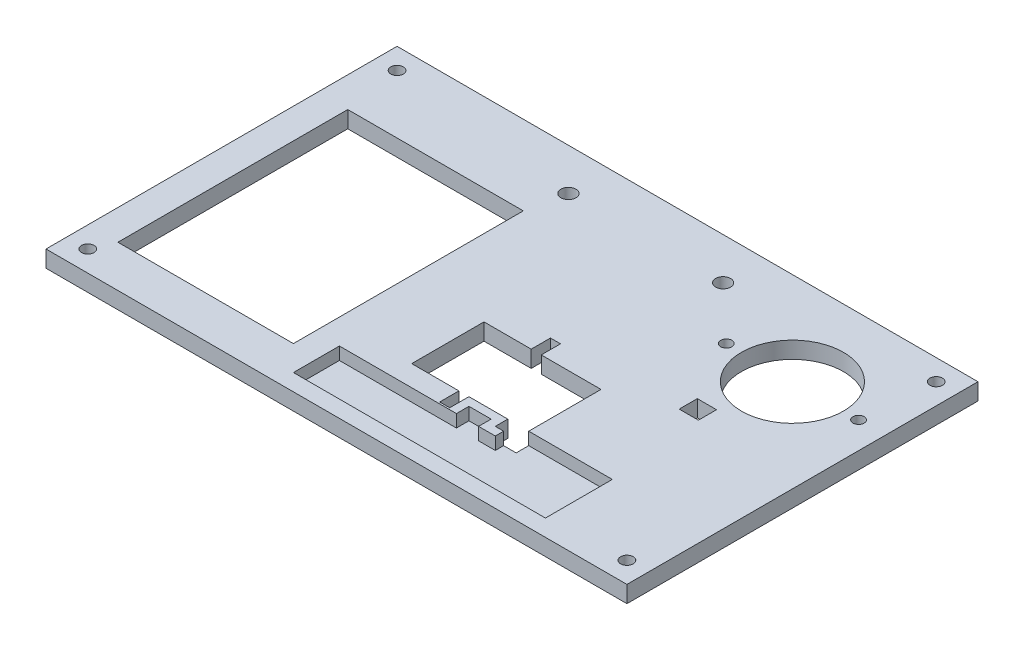
from build123d import *

# Parameters (mm, degrees)
BOSS_EXTRUDE1_DEPTH = 5.08
SKETCH3_R           = 1.905
CUT_EXTRUDE1_DEPTH  = 104.255373831
SKETCH4_R           = 1.905
SKETCH4_R_2         = 2.286
CUT_EXTRUDE2_DEPTH  = 104.255373831
CUT_EXTRUDE3_DEPTH  = 104.255373831
SKETCH6_R           = 15.494
SKETCH6_R_2         = 1.7
CUT_EXTRUDE4_DEPTH  = 104.255373831
SKETCH7_W           = 53.34
SKETCH7_H           = 69.85
CUT_EXTRUDE5_DEPTH  = 104.255373831
SKETCH8_W           = 5.838418679
SKETCH8_H           = 5.514062087
CUT_EXTRUDE6_DEPTH  = 104.255373831
CUT_EXTRUDE7_DEPTH  = 3.81


with BuildPart() as part:
    # Sketch1 → Boss-Extrude1 (new body)
    with BuildSketch(Plane(origin=(0, 0, 0), x_dir=(1, 0, 0), z_dir=(0, 1, 0))):
        Polygon((-15.621, -53.34), (15.621, -53.34), (88.265, -53.34), (88.265, 53.34), (-88.265, 53.34), (-88.265, -53.34), align=None)
    extrude(amount=BOSS_EXTRUDE1_DEPTH)

    # Sketch3 → Cut-Extrude1 (cut, through all)
    with BuildSketch(Plane(origin=(0, 5.08, 0), x_dir=(1, 0, 0), z_dir=(0, 1, 0))):
        with Locations(Location((-81.915, 46.99, 0), (0, 0, 270))):
            Circle(SKETCH3_R)
    extrude(amount=-CUT_EXTRUDE1_DEPTH, mode=Mode.SUBTRACT)

    # Sketch4 → Cut-Extrude2 (cut, through all)
    with BuildSketch(Plane(origin=(0, 5.08, 0), x_dir=(1, 0, 0), z_dir=(0, 1, 0))):
        with Locations(Location((81.915, 46.99, 0), (0, 0, 270))):
            Circle(SKETCH4_R)
        with Locations(Location((-81.915, -46.99, 0), (0, 0, 270))):
            Circle(SKETCH4_R)
        with Locations(Location((81.915, -46.99, 0), (0, 0, 270))):
            Circle(SKETCH4_R)
        with Locations(Location((23.495, 40.64, 0), (0, 0, 270))):
            Circle(SKETCH4_R_2)
        with Locations(Location((-23.495, 40.64, 0), (0, 0, 270))):
            Circle(SKETCH4_R_2)
    extrude(amount=-CUT_EXTRUDE2_DEPTH, mode=Mode.SUBTRACT)

    # Sketch5 → Cut-Extrude3 (cut, through all)
    with BuildSketch(Plane.XZ):
        Polygon((-2.54, 27.94), (-2.54, 5.969), (11.811, 5.969), (11.811, 0.127), (14.859, 0.127), (14.859, 5.969), (33.02, 5.969), (33.02, 29.21), (33.02, 31.75), (26.67, 31.75), (26.67, 27.94), (25.80916534, 27.94), (14.859, 27.94), (14.859, 33.782), (11.811, 33.782), (11.811, 27.94), align=None)
    extrude(amount=-CUT_EXTRUDE3_DEPTH, mode=Mode.SUBTRACT)

    # Sketch6 → Cut-Extrude4 (cut, through all)
    with BuildSketch(Plane(origin=(0, 5.08, 0), x_dir=(1, 0, 0), z_dir=(0, 1, 0))):
        with Locations(Location((60.071, 25.146, 0), (0, 0, 270))):
            Circle(SKETCH6_R)
        with Locations(Location((39.9778, 25.146, 0), (0, 0, 270))):
            Circle(SKETCH6_R_2)
        with Locations(Location((80.1642, 25.146, 0), (0, 0, 270))):
            Circle(SKETCH6_R_2)
    extrude(amount=-CUT_EXTRUDE4_DEPTH, mode=Mode.SUBTRACT)

    # Sketch7 → Cut-Extrude5 (cut, through all)
    with BuildSketch(Plane(origin=(0, 5.08, 0), x_dir=(1, 0, 0), z_dir=(0, 1, 0))):
        with Locations((-52.451, -5.715)):
            Rectangle(SKETCH7_W, SKETCH7_H)
    extrude(amount=-CUT_EXTRUDE5_DEPTH, mode=Mode.SUBTRACT)

    # Sketch8 → Cut-Extrude6 (cut, through all)
    with BuildSketch(Plane(origin=(0, 5.08, 0), x_dir=(1, 0, 0), z_dir=(0, 1, 0))):
        with Locations((52.991758435, 3.486833379)):
            Rectangle(SKETCH8_W, SKETCH8_H)
    extrude(amount=-CUT_EXTRUDE6_DEPTH, mode=Mode.SUBTRACT)

    # Sketch9 → Cut-Extrude7 (cut)
    with BuildSketch(Plane(origin=(0, 5.08, 0), x_dir=(1, 0, 0), z_dir=(0, 1, 0))):
        Polygon((29.21, -27.94), (58.42, -27.94), (58.42, -48.26), (32.552533169, -48.26), (-18.161, -48.26), (-18.161, -34.29), (17.399, -34.29), (17.399, -30.48), (24.13, -30.48), (24.13, -34.29), (29.21, -34.29), align=None)
    extrude(amount=-CUT_EXTRUDE7_DEPTH, mode=Mode.SUBTRACT)


solid = part.part
